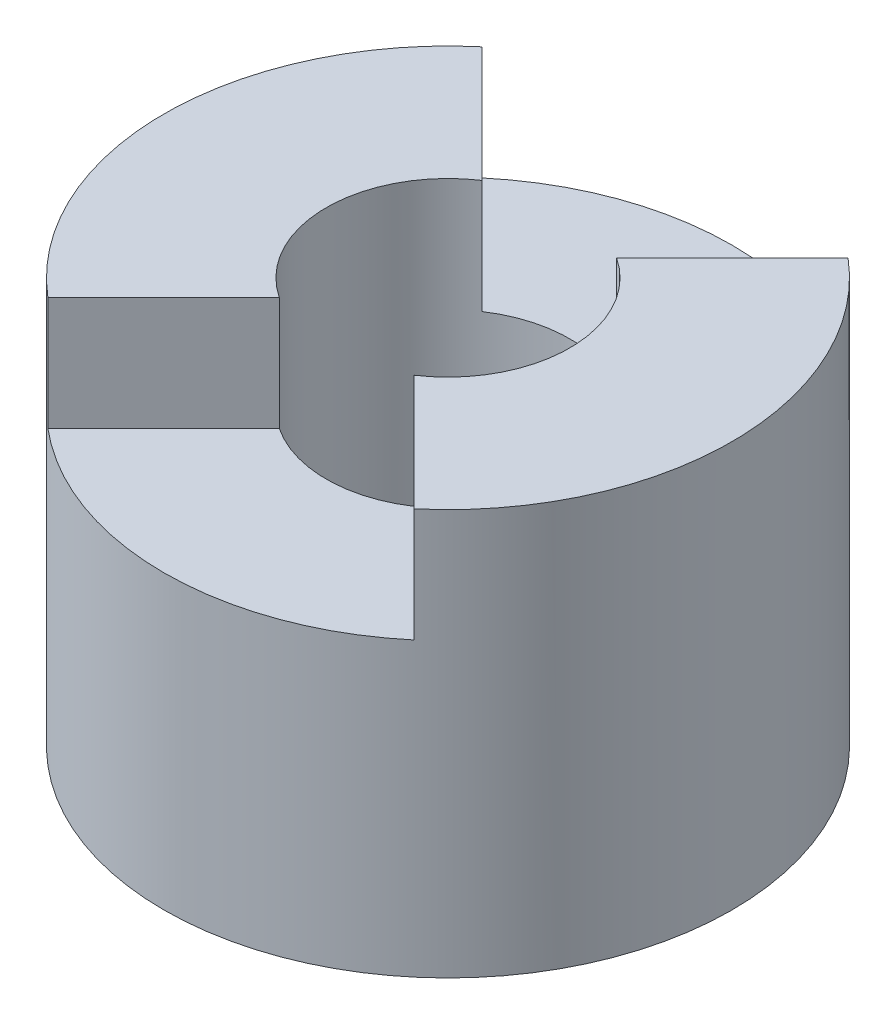
from build123d import *

# Parameters (mm, degrees)
SKETCH1_R           = 35
SKETCH1_R_2         = 15
BOSS_EXTRUDE1_DEPTH = 50
CUT_EXTRUDE1_START  = -14
CUT_EXTRUDE1_DEPTH  = 14


with BuildPart() as part:
    # Sketch1 → Boss-Extrude1 (new body)
    with BuildSketch(Plane(origin=(0, 0, 0), x_dir=(1, 0, 0), z_dir=(0, 1, 0))):
        with Locations(Location((0, 0, 0), (0, 0, 270))):
            Circle(SKETCH1_R)
        with Locations(Location((0, 0, 0), (0, 0, 270))):
            Circle(SKETCH1_R_2, mode=Mode.SUBTRACT)
    extrude(amount=BOSS_EXTRUDE1_DEPTH)

    # Sketch2 → Cut-Extrude1 (cut)
    with BuildSketch(Plane(origin=(0, 50, 0), x_dir=(1, 0, 0), z_dir=(0, 1, 0)).offset(CUT_EXTRUDE1_START)):
        with BuildLine():
            Line((8.291561976, -12.5), (22.554902269, -26.763340293))
            ThreePointArc((22.554902269, -26.763340293), (0, -35), (-22.554902269, -26.763340293))
            Line((-22.554902269, -26.763340293), (-8.291561976, -12.5))
            ThreePointArc((-8.291561976, -12.5), (0, -15), (8.291561976, -12.5))
        make_face()
    cut_extrude1 = extrude(amount=CUT_EXTRUDE1_DEPTH, mode=Mode.SUBTRACT)

    # Mirror1: Cut-Extrude1 across plane
    add(cut_extrude1.mirror(Plane.XY), mode=Mode.SUBTRACT)


solid = part.part
